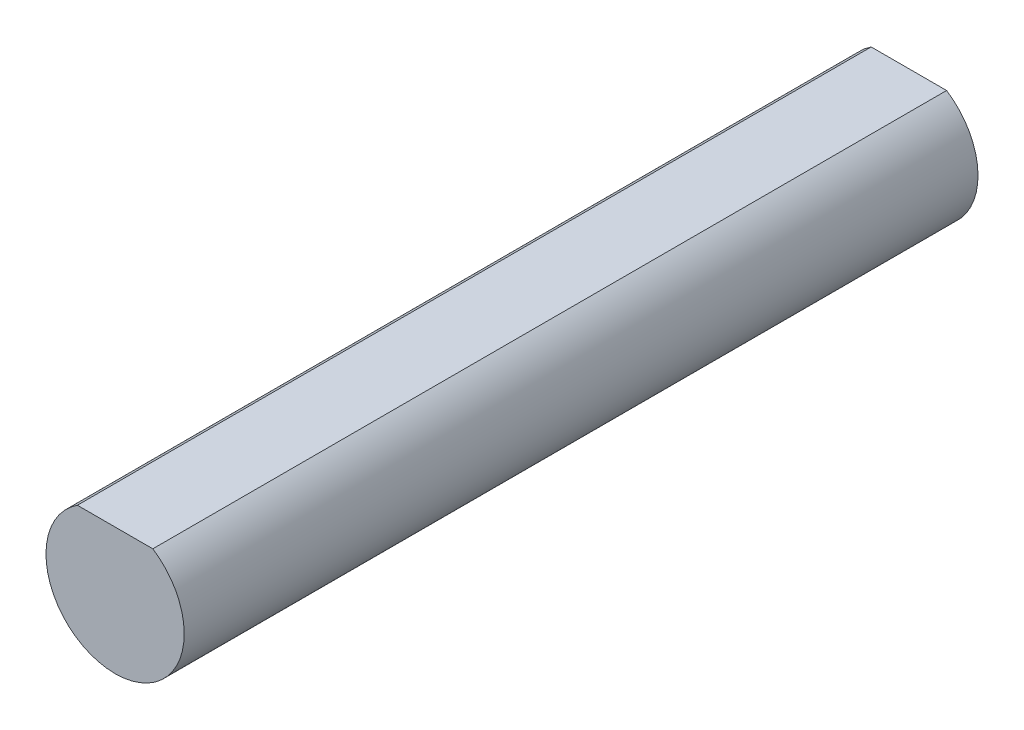
from build123d import *

# Parameters (mm, degrees)
SKETCH_1_R          = 7.4
EXTRUDE_1_DEPTH     = 85
SKETCH_2_W          = 22.961609007
SKETCH_2_H          = 4.894916649
CUT_EXTRUDE_1_DEPTH = 86.641812218


with BuildPart() as part:
    # 草图1 → 凸台-拉伸1 (new body)
    with BuildSketch(Plane.XY):
        Circle(SKETCH_1_R)
    extrude(amount=EXTRUDE_1_DEPTH)

    # 草图2 → 切除-拉伸1 (cut, through all)
    with BuildSketch(Plane.XY.offset(85)):
        with Locations((0.019418579, 8.647458325)):
            Rectangle(SKETCH_2_W, SKETCH_2_H)
    extrude(amount=-CUT_EXTRUDE_1_DEPTH, mode=Mode.SUBTRACT)


solid = part.part
